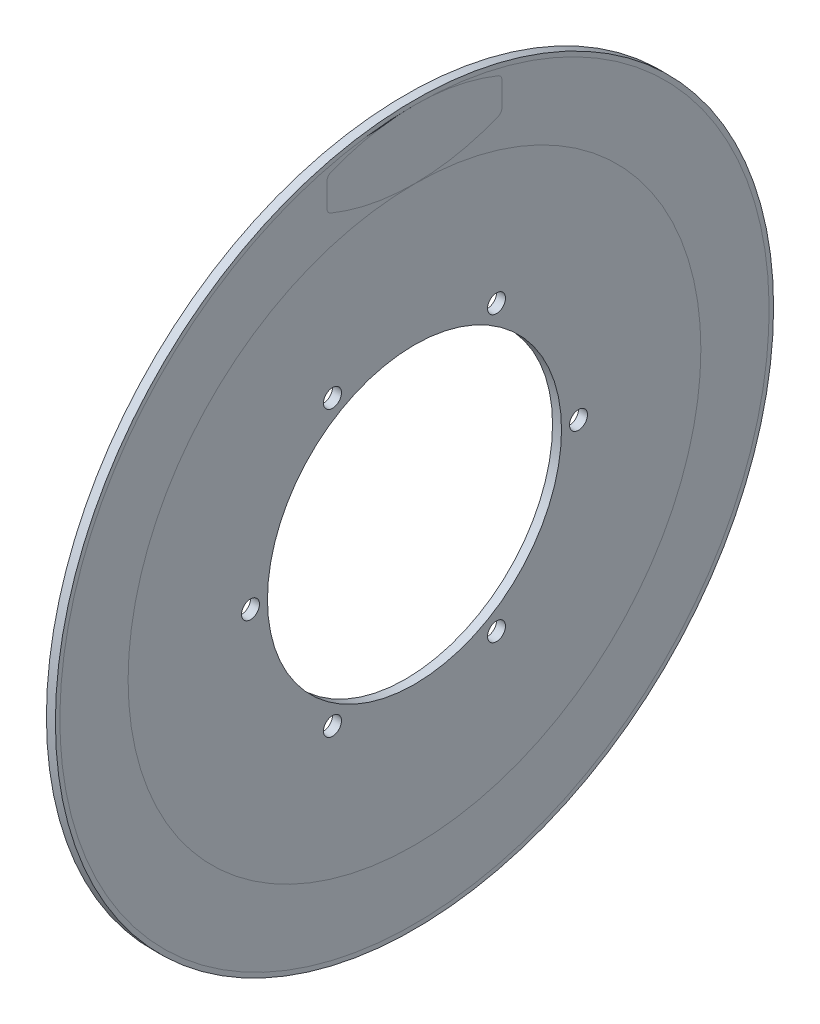
from build123d import *

# Parameters (mm, degrees)
SKETCH1_R           = 127
SKETCH1_R_2         = 3.175
BOSS_EXTRUDE1_DEPTH = 3.175


with BuildPart() as part:
    # Sketch1 → Boss-Extrude1 (new body)
    with BuildSketch(Plane(origin=(0, 0, 0), x_dir=(0, 0, -1), z_dir=(1, 0, 0))):
        Circle(SKETCH1_R)
        with Locations((-29, -50.229473419)):
            Circle(SKETCH1_R_2, mode=Mode.SUBTRACT)
        with Locations((29, -50.229473419)):
            Circle(SKETCH1_R_2, mode=Mode.SUBTRACT)
        with Locations((-58, 0)):
            Circle(SKETCH1_R_2, mode=Mode.SUBTRACT)
        with Locations((-29, 50.229473419)):
            Circle(SKETCH1_R_2, mode=Mode.SUBTRACT)
        with BuildLine():
            ThreePointArc((26, 45.033320997), (45.033320997, 26), (52, 0))
            ThreePointArc((52, 0), (-45.033320997, -26), (26, 45.033320997))
        make_face(mode=Mode.SUBTRACT)
        with Locations((58, 0)):
            Circle(SKETCH1_R_2, mode=Mode.SUBTRACT)
        with Locations((29, 50.229473419)):
            Circle(SKETCH1_R_2, mode=Mode.SUBTRACT)
    extrude(amount=BOSS_EXTRUDE1_DEPTH)


solid = part.part
